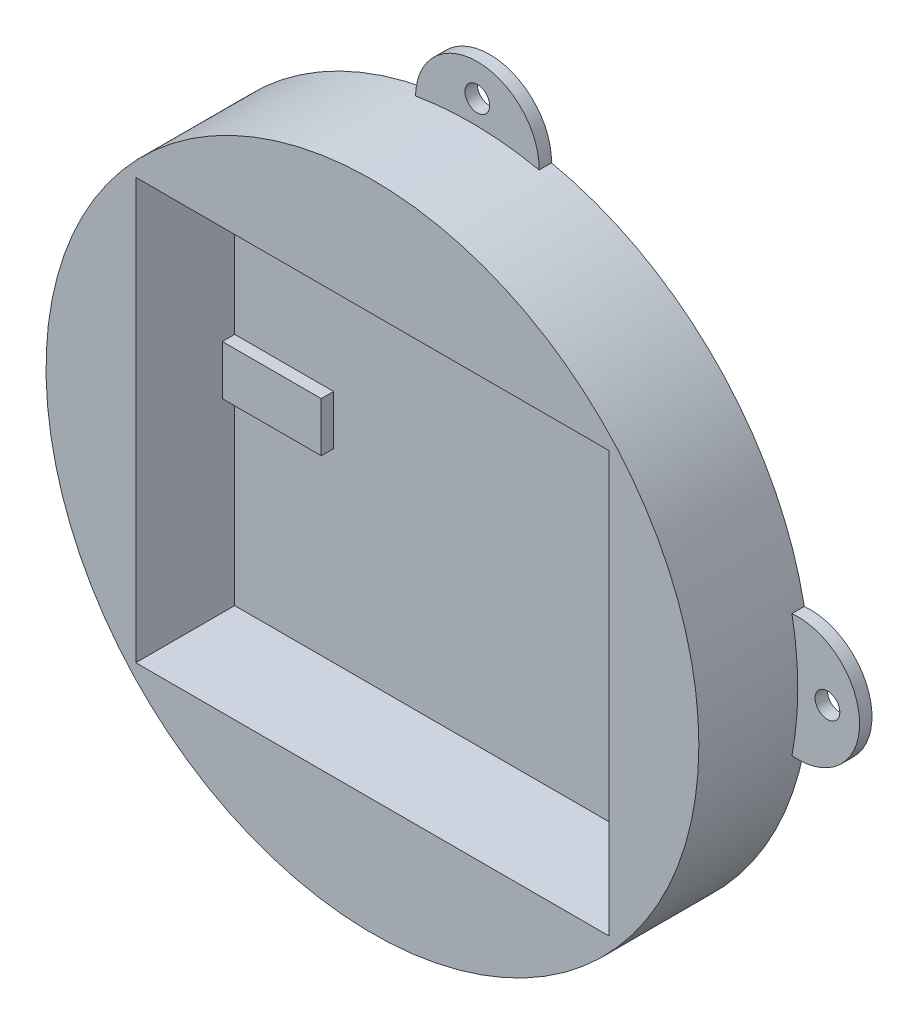
from build123d import *

# Parameters (mm, degrees)
SKETCH1_R           = 132
BOSS_EXTRUDE1_DEPTH = 5
SKETCH2_R           = 132
SKETCH2_R_2         = 128
BOSS_EXTRUDE2_DEPTH = 40
BOSS_EXTRUDE3_DEPTH = 40
SKETCH6_W           = 40
SKETCH6_H           = 20
BOSS_EXTRUDE5_DEPTH = 5
SKETCH7_W           = 40
SKETCH7_H           = 20
CUT_EXTRUDE1_DEPTH  = 5
SKETCH8_W           = 40
SKETCH8_H           = 10
BOSS_EXTRUDE7_DEPTH = 5
SKETCH9_R           = 5
BOSS_EXTRUDE8_DEPTH = 5
CIRPATTERN1_COUNT   = 4


with BuildPart() as part:
    # Sketch1 → Boss-Extrude1 (new body)
    with BuildSketch(Plane.XY):
        Circle(SKETCH1_R)
    extrude(amount=BOSS_EXTRUDE1_DEPTH)

    # Sketch2 → Boss-Extrude2 (add)
    with BuildSketch(Plane.XY.offset(5)):
        Circle(SKETCH2_R)
        Circle(SKETCH2_R_2, mode=Mode.SUBTRACT)
    extrude(amount=BOSS_EXTRUDE2_DEPTH)

    # Sketch3 → Boss-Extrude3 (add)
    with BuildSketch(Plane.XY.offset(5)):
        with BuildLine():
            ThreePointArc((95.710026061, 84.99171084), (0, 128), (-95.710026061, 84.99171084))
            Line((-95.710026061, 84.99171084), (95.710026061, 84.99171084))
        make_face()
        with BuildLine():
            Line((95.710026061, 84.99171084), (95.710026061, -84.99171084))
            ThreePointArc((95.710026061, -84.99171084), (119.655512484, -45.45941412), (128, 0))
            ThreePointArc((128, 0), (119.655512484, 45.45941412), (95.710026061, 84.99171084))
        make_face()
        with BuildLine():
            Line((95.710026061, -84.99171084), (-95.710026061, -84.99171084))
            ThreePointArc((-95.710026061, -84.99171084), (0, -128), (95.710026061, -84.99171084))
        make_face()
        with BuildLine():
            ThreePointArc((-95.710026061, 84.99171084), (-128, 0), (-95.710026061, -84.99171084))
            Line((-95.710026061, -84.99171084), (-95.710026061, 84.99171084))
        make_face()
    extrude(amount=BOSS_EXTRUDE3_DEPTH)

    # Sketch6 → Boss-Extrude5 (add)
    with BuildSketch(Plane.XY.offset(5)):
        with Locations((-50, 0)):
            Rectangle(SKETCH6_W, SKETCH6_H)
    extrude(amount=BOSS_EXTRUDE5_DEPTH)

    # Sketch7 → Cut-Extrude1 (cut)
    with BuildSketch(Plane.XY.offset(10)):
        with Locations((-50, 0)):
            Rectangle(SKETCH7_W, SKETCH7_H)
    extrude(amount=-CUT_EXTRUDE1_DEPTH, mode=Mode.SUBTRACT)

    # Sketch8 → Boss-Extrude7 (add)
    with BuildSketch(Plane.XY.offset(5)):
        with Locations((-75.710026061, -5)):
            Rectangle(SKETCH8_W, SKETCH8_H)
        with Locations((-75.710026061, 5)):
            Rectangle(SKETCH8_W, SKETCH8_H)
    extrude(amount=BOSS_EXTRUDE7_DEPTH)

    # Sketch9 → Boss-Extrude8 (add)
    with BuildSketch(Plane(origin=(0, 0, 0), x_dir=(-1, 0, 0), z_dir=(0, 0, -1))):
        with BuildLine():
            ThreePointArc((-129.632575758, -24.887653615), (-132, 0), (-129.632575758, 24.887653615))
            ThreePointArc((-129.632575758, 24.887653615), (-157, 0), (-129.632575758, -24.887653615))
        make_face()
        with Locations((-144, 0)):
            Circle(SKETCH9_R, mode=Mode.SUBTRACT)
    boss_extrude8 = extrude(amount=-BOSS_EXTRUDE8_DEPTH)

    # CirPattern1: Boss-Extrude8 ×4 about axis
    cirpattern1_axis = Axis((2.404422144, 0, 0), (0, 0, 1))
    for i in range(1, CIRPATTERN1_COUNT):
        add(boss_extrude8.rotate(cirpattern1_axis, i * 360 / CIRPATTERN1_COUNT))


solid = part.part
